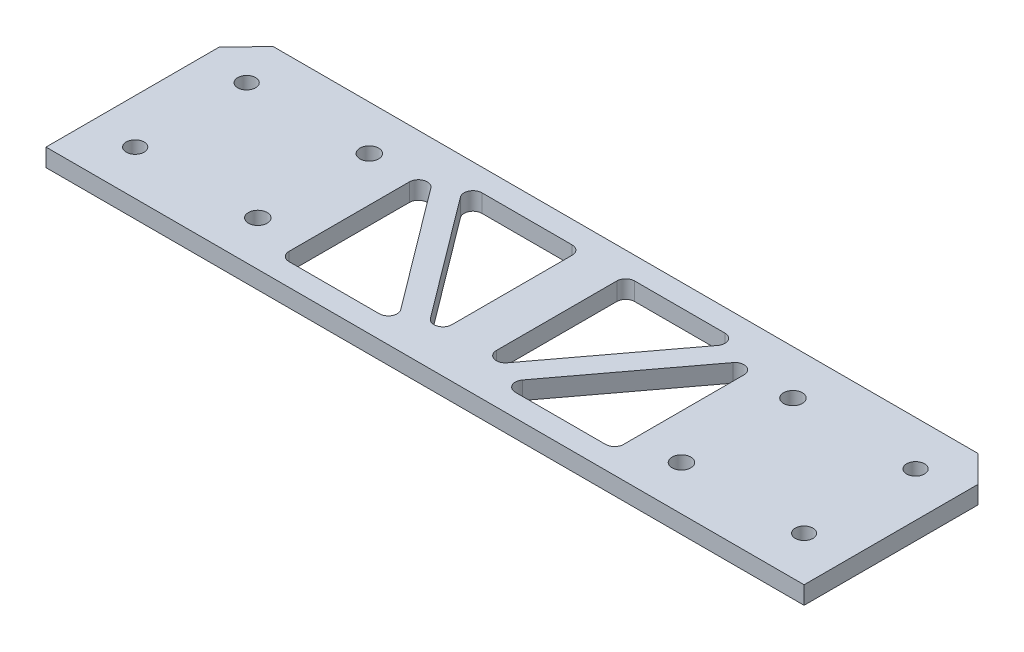
from build123d import *

# Parameters (mm, degrees)
SKETCH_1_W          = 170
SKETCH_1_H          = 45
SKETCH_1_R          = 2
SKETCH_1_R_2        = 2.1
EXTRUDE_1_DEPTH     = 4
CUT_EXTRUDE_1_DEPTH = 4
CUT_EXTRUDE_2_DEPTH = 4
FILLET_1_R          = 2


with BuildPart() as part:
    # 草图1 → 凸台-拉伸1 (new body)
    with BuildSketch(Plane(origin=(0, 0, 0), x_dir=(1, 0, 0), z_dir=(0, 1, 0))):
        with Locations((85, 22.5)):
            Rectangle(SKETCH_1_W, SKETCH_1_H)
        with Locations(Location((10, 35, 0), (0, 0, 270))):
            Circle(SKETCH_1_R, mode=Mode.SUBTRACT)
        with Locations(Location((10, 10, 0), (0, 0, 270))):
            Circle(SKETCH_1_R, mode=Mode.SUBTRACT)
        with Locations(Location((160, 10, 0), (0, 0, 270))):
            Circle(SKETCH_1_R, mode=Mode.SUBTRACT)
        with Locations(Location((160, 35, 0), (0, 0, 270))):
            Circle(SKETCH_1_R, mode=Mode.SUBTRACT)
        with Locations(Location((37.5, 35, 0), (0, 0, 270))):
            Circle(SKETCH_1_R_2, mode=Mode.SUBTRACT)
        with Locations(Location((37.5, 10, 0), (0, 0, 270))):
            Circle(SKETCH_1_R_2, mode=Mode.SUBTRACT)
        with Locations(Location((132.5, 10, 0), (0, 0, 270))):
            Circle(SKETCH_1_R_2, mode=Mode.SUBTRACT)
        with Locations(Location((132.5, 35, 0), (0, 0, 270))):
            Circle(SKETCH_1_R_2, mode=Mode.SUBTRACT)
    extrude(amount=EXTRUDE_1_DEPTH)

    # 草图4 → 切除-拉伸1 (cut)
    with BuildSketch(Plane(origin=(0, 4, 0), x_dir=(1, 0, 0), z_dir=(0, 1, 0))):
        Polygon((0, 38.909451479), (6, 45), (0, 45), align=None)
        Polygon((170, 39), (164, 45), (170, 45), align=None)
    extrude(amount=-CUT_EXTRUDE_1_DEPTH, mode=Mode.SUBTRACT)

    # 草图5 → 切除-拉伸2 (cut)
    with BuildSketch(Plane.XZ):
        Polygon((47.5, -5), (47.5, -40), (73.75, -5), align=None)
        Polygon((53.75, -40), (80, -5), (80, -40), align=None)
        Polygon((90, -5), (90, -40), (116.25, -40), align=None)
        Polygon((96.25, -5), (122.5, -5), (122.5, -40), align=None)
    extrude(amount=-CUT_EXTRUDE_2_DEPTH, mode=Mode.SUBTRACT)

    # 圆角1
    fillet_1_edges = [part.edges().sort_by_distance(p)[0] for p in [
        (80, 2, -5),
        (53.75, 2, -40),
        (80, 2, -40),
        (90, 2, -40),
        (116.25, 2, -40),
        (90, 2, -5),
        (122.5, 2, -5),
        (96.25, 2, -5),
        (122.5, 2, -40),
        (47.5, 2, -40),
        (73.75, 2, -5),
        (47.5, 2, -5),
    ]]
    fillet(fillet_1_edges, radius=FILLET_1_R)


solid = part.part
